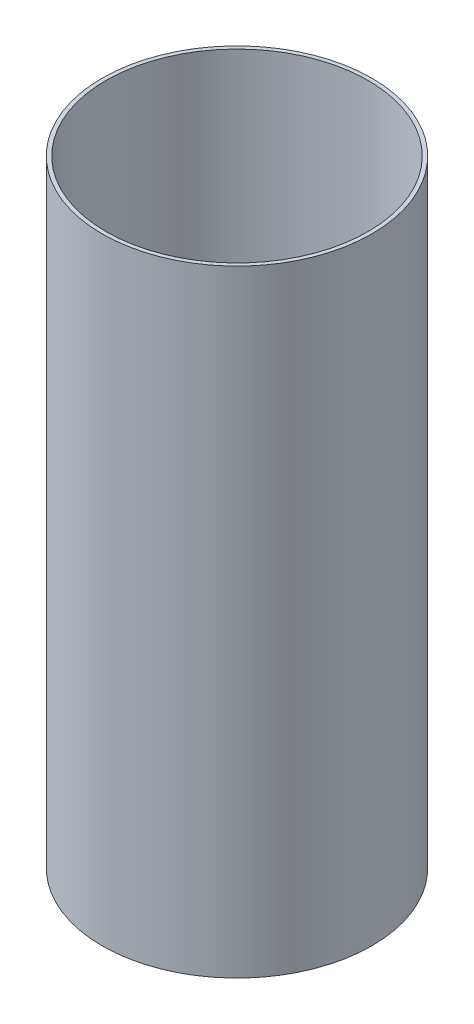
from build123d import *

# Parameters (mm, degrees)
ESBO_O1_R                = 35
ESBO_O1_R_2              = 34
RESSALTO_EXTRUS_O1_DEPTH = 160


with BuildPart() as part:
    # Esboço1 → Ressalto-extrusão1 (new body)
    with BuildSketch(Plane(origin=(0, 0, 0), x_dir=(1, 0, 0), z_dir=(0, 1, 0))):
        with Locations(Location((0, 0, 0), (0, 0, 270))):
            Circle(ESBO_O1_R)
        with Locations(Location((0, 0, 0), (0, 0, 270))):
            Circle(ESBO_O1_R_2, mode=Mode.SUBTRACT)
    extrude(amount=RESSALTO_EXTRUS_O1_DEPTH)


solid = part.part
